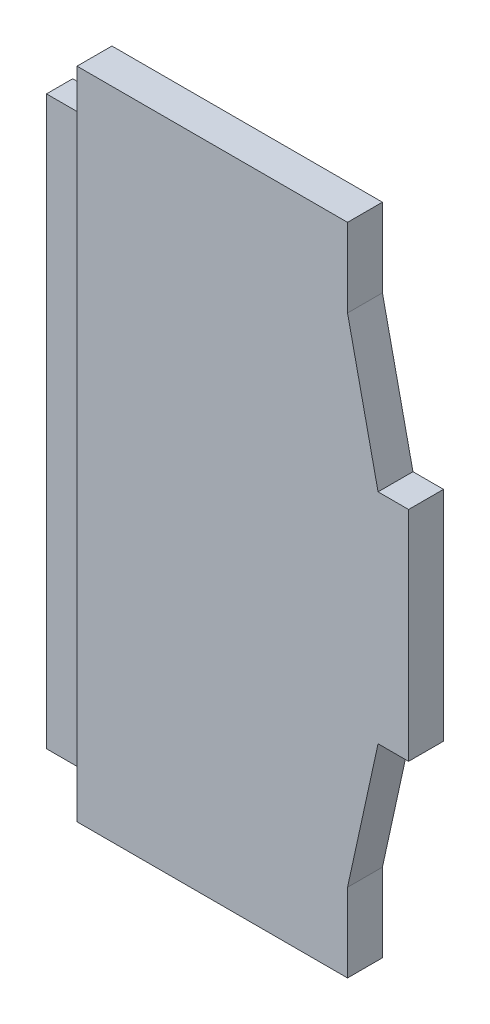
from build123d import *

# Parameters (mm, degrees)
BOSS_EXTRUDE1_DEPTH = 4
SKETCH3_W           = 3
SKETCH3_H           = 65
BOSS_EXTRUDE2_DEPTH = 4


with BuildPart() as part:
    # Sketch1 → Boss-Extrude1 (new body)
    with BuildSketch(Plane.XY):
        Polygon((0, 0), (31, 0), (31, 9), (34.5, 25), (38, 25), (38, 50), (34.5, 50), (31, 66), (31, 75), (0, 75), align=None)
    extrude(amount=BOSS_EXTRUDE1_DEPTH)

    # Sketch3 → Boss-Extrude2 (add)
    with BuildSketch(Plane.ZY):
        with Locations((2, 37.5)):
            Rectangle(SKETCH3_W, SKETCH3_H)
    extrude(amount=BOSS_EXTRUDE2_DEPTH)


solid = part.part
